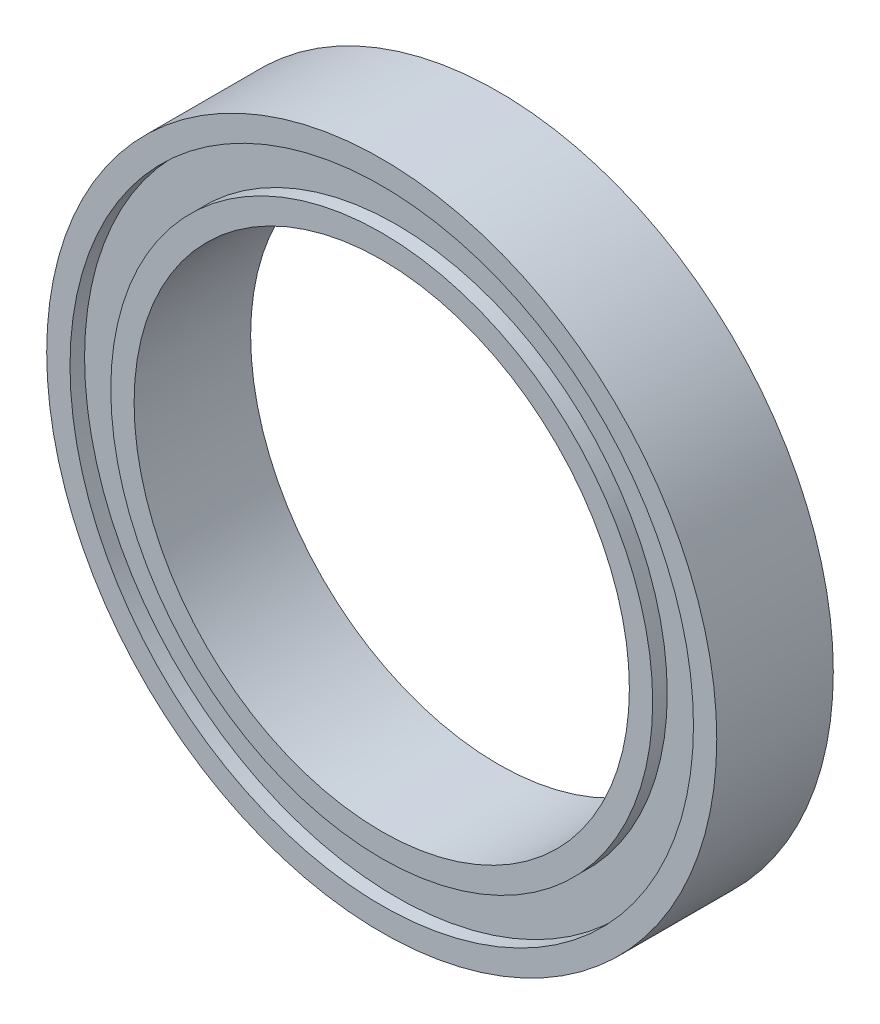
from build123d import *

# Parameters (mm, degrees)
SKETCH_1_R          = 11.5
SKETCH_1_R_2        = 8.5
EXTRUDE_1_DEPTH     = 4
SKETCH_2_R          = 10.7
SKETCH_2_R_2        = 9.3
CUT_EXTRUDE_1_DEPTH = 0.5
CUT_EXTRUDE_START   = -0.5
SKETCH_3_R          = 10.7
SKETCH_3_R_2        = 9.3
CUT_EXTRUDE_2_DEPTH = 0.5


with BuildPart() as part:
    # 草图1 → 凸台-拉伸1 (new body)
    with BuildSketch(Plane.XY):
        Circle(SKETCH_1_R)
        Circle(SKETCH_1_R_2, mode=Mode.SUBTRACT)
    extrude(amount=EXTRUDE_1_DEPTH)

    # 草图2 → 切除-拉伸1 (cut)
    with BuildSketch(Plane.XY.offset(4)):
        Circle(SKETCH_2_R)
        Circle(SKETCH_2_R_2, mode=Mode.SUBTRACT)
    extrude(amount=-CUT_EXTRUDE_1_DEPTH, mode=Mode.SUBTRACT)

    # 草图3 → 切除-拉伸2 (cut)
    with BuildSketch(Plane(origin=(0, 0, 0), x_dir=(-1, 0, 0), z_dir=(0, 0, -1)).offset(CUT_EXTRUDE_START)):
        with Locations(Location((0, 0, 0), (0, 0, 180))):
            Circle(SKETCH_3_R)
        with Locations(Location((0, 0, 0), (0, 0, 180))):
            Circle(SKETCH_3_R_2, mode=Mode.SUBTRACT)
    extrude(amount=CUT_EXTRUDE_2_DEPTH, mode=Mode.SUBTRACT)


solid = part.part
